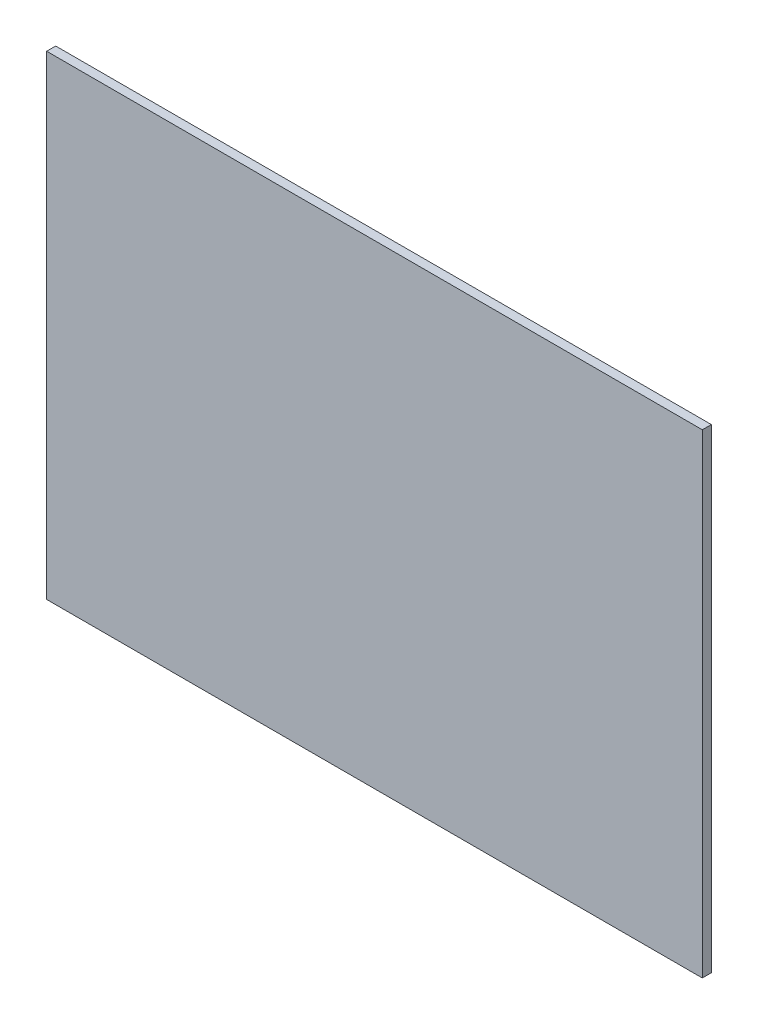
from build123d import *

# Parameters (mm, degrees)
SKETCH1_W           = 290
SKETCH1_H           = 210
BOSS_EXTRUDE1_DEPTH = 4


with BuildPart() as part:
    # Sketch1 → Boss-Extrude1 (new body)
    with BuildSketch(Plane.XY):
        Rectangle(SKETCH1_W, SKETCH1_H)
    extrude(amount=BOSS_EXTRUDE1_DEPTH)


solid = part.part
